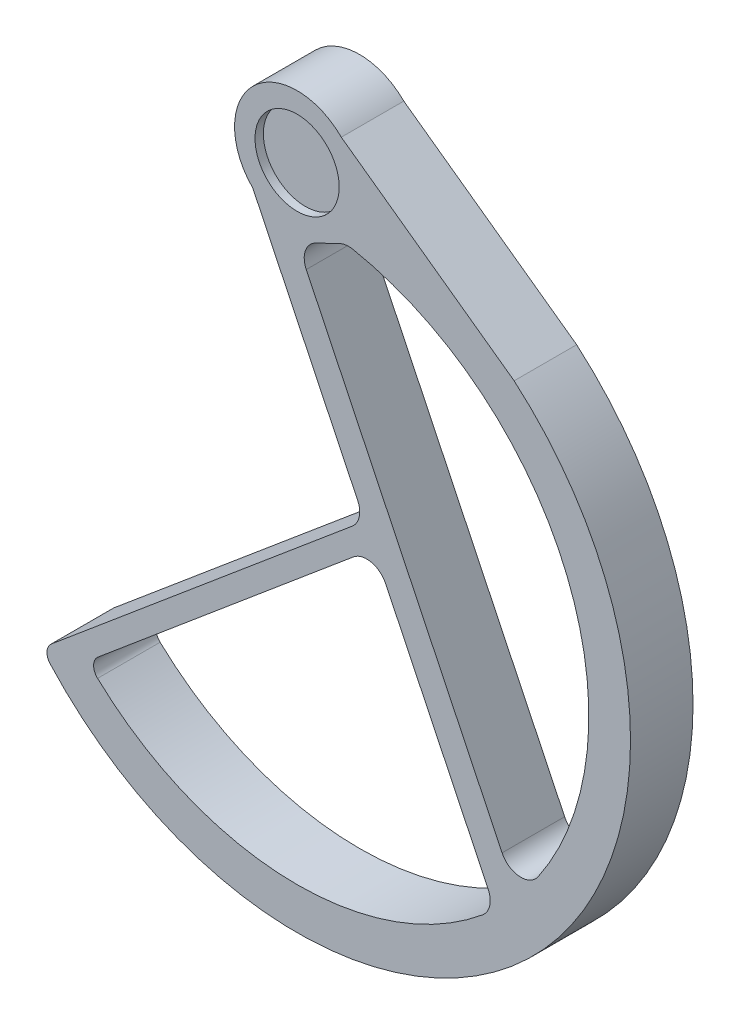
from build123d import *

# Parameters (mm, degrees)
EXTRUDE_1_DEPTH     = 15
CUT_EXTRUDE_START   = -15
CUT_EXTRUDE_1_DEPTH = 15
SKETCH_7_R          = 10.1
CUT_EXTRUDE_2_DEPTH = 2


with BuildPart() as part:
    # ｽｹｯﾁ4 → ﾎﾞｽ - 押し出し1 (new body)
    with BuildSketch(Plane.XY):
        with BuildLine():
            Line((-53.623111018, -124.995132678), (-58.940636287, -129.45706617))
            ThreePointArc((-58.940636287, -129.45706617), (-60.005384698, -131.552012131), (-59.233530865, -133.771635843))
            ThreePointArc((-59.233530865, -133.771635843), (57.362306223, -135.763481103), (52.076178918, -19.270504783))
            Line((52.076178918, -19.270504783), (10.606601718, 10.606601718))
            ThreePointArc((10.606601718, 10.606601718), (-10.606601718, 10.606601718), (-10.606601718, -10.606601718))
            Line((-10.606601718, -10.606601718), (14.536280154, -62.889638219))
            ThreePointArc((14.536280154, -62.889638219), (14.918089499, -66.109676181), (13.244185189, -68.886809092))
            Line((13.244185189, -68.886809092), (-53.623111018, -124.995132678))
        make_face()
        with BuildLine():
            Line((21.232400696, -76.813798404), (45.844843506, -127.993820346))
            ThreePointArc((45.844843506, -127.993820346), (46.221944165, -131.235480845), (44.518718993, -134.019289696))
            ThreePointArc((44.518718993, -134.019289696), (-2.231208213, -149.964431749), (-47.870174388, -131.072951785))
            ThreePointArc((-47.870174388, -131.072951785), (-48.817477846, -128.802229421), (-47.747678417, -126.586582094))
            Line((-47.747678417, -126.586582094), (13.511229465, -75.151532228))
            ThreePointArc((13.511229465, -75.151532228), (17.77869109, -74.092739753), (21.232400696, -76.813798404))
        make_face(mode=Mode.SUBTRACT)
    extrude(amount=EXTRUDE_1_DEPTH)

    # ｽｹｯﾁ6 → ｶｯﾄ - 押し出し1 (cut)
    with BuildSketch(Plane.XY.offset(15).offset(CUT_EXTRUDE_START)):
        with BuildLine():
            Line((49.189589797, -118.797265215), (2.201751786, -21.089020696))
            ThreePointArc((2.201751786, -21.089020696), (1.989274209, -17.268089629), (4.540836142, -14.416039025))
            Line((4.540836142, -14.416039025), (6.483415605, -13.48185369))
            Line((6.483415605, -13.48185369), (10.219658847, -11.685096486))
            ThreePointArc((10.219658847, -11.685096486), (11.747077013, -11.232198087), (13.339423466, -11.282754846))
            ThreePointArc((13.339423466, -11.282754846), (64.738421392, -53.37413296), (57.826055334, -119.448033215))
            ThreePointArc((57.826055334, -119.448033215), (53.319931874, -121.616182211), (49.189589797, -118.797265215))
        make_face()
    extrude(amount=CUT_EXTRUDE_1_DEPTH, mode=Mode.SUBTRACT)

    # ｽｹｯﾁ7 → ｶｯﾄ - 押し出し2 (cut)
    with BuildSketch(Plane.XY.offset(15)):
        Circle(SKETCH_7_R)
    extrude(amount=-CUT_EXTRUDE_2_DEPTH, mode=Mode.SUBTRACT)


solid = part.part
